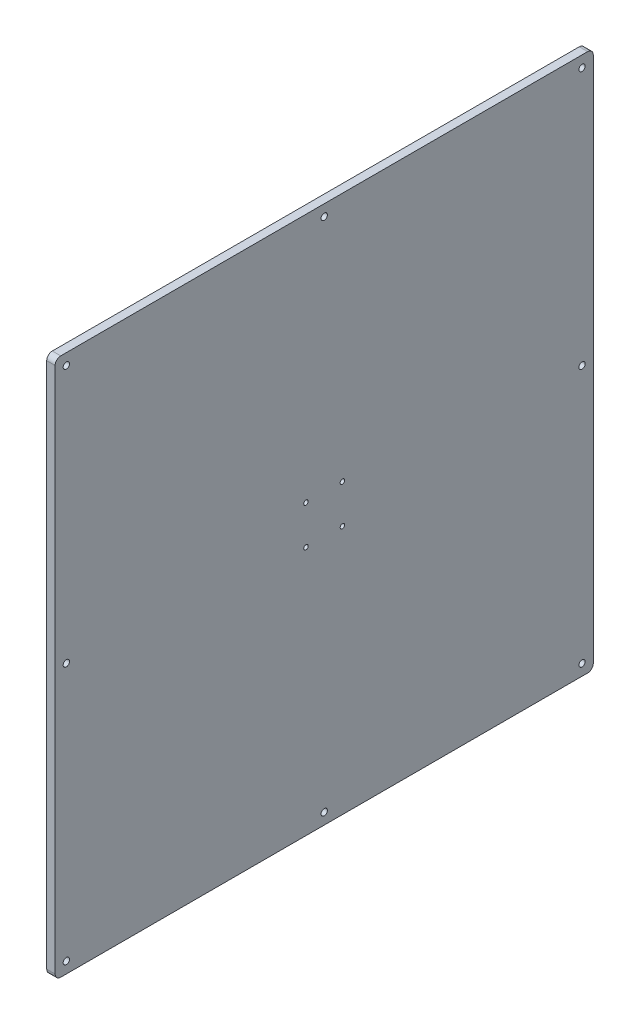
from build123d import *

# Parameters (mm, degrees)
SKETCH1_W               = 609.6
SKETCH1_H               = 609.6
BOSS_EXTRUDE1_DEPTH     = 9.525
F_1_4_20_TAPPED_HOLE1_D = 5.1054
FILLET1_R               = 6.35
F_1_4_CLEARANCE_HOLE1_D = 7.14248


with BuildPart() as part:
    # Sketch1 → Boss-Extrude1 (new body)
    with BuildSketch(Plane(origin=(0, 0, 0), x_dir=(0, 0, -1), z_dir=(1, 0, 0))):
        Rectangle(SKETCH1_W, SKETCH1_H)
    extrude(amount=BOSS_EXTRUDE1_DEPTH)

    # 1/4-20 Tapped Hole1 (through all)
    with Locations(Plane(origin=(9.525, 0, 0), x_dir=(0, 0, -1), z_dir=(1, 0, 0))):
        with Locations((-20.6375, 21.9075), (20.6375, 21.9075), (20.6375, -21.9075), (-20.6375, -21.9075)):
            Hole(F_1_4_20_TAPPED_HOLE1_D / 2)

    # Fillet1
    fillet1_edges = [part.edges().sort_by_distance(p)[0] for p in [
        (4.7625, -304.8, 304.8),
        (4.7625, -304.8, -304.8),
        (4.7625, 304.8, -304.8),
        (4.7625, 304.8, 304.8),
    ]]
    fillet(fillet1_edges, radius=FILLET1_R)

    # 1/4 Clearance Hole1 (through all)
    with Locations(Plane(origin=(9.525, 0, 0), x_dir=(0, 0, -1), z_dir=(1, 0, 0))):
        with Locations((-292.1, 292.1), (292.1, 292.1), (292.1, -292.1), (-292.1, -292.1), (0, 292.1), (-292.1, 0), (0, -292.1), (292.1, 0)):
            Hole(F_1_4_CLEARANCE_HOLE1_D / 2)


solid = part.part
